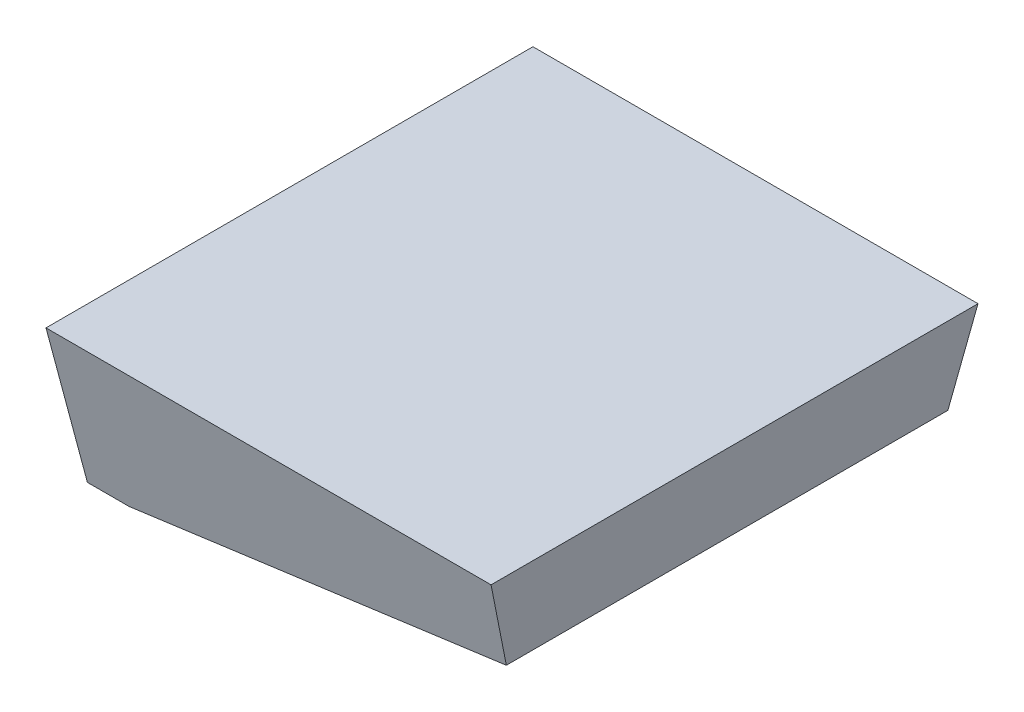
from build123d import *

# Parameters (mm, degrees)
TD_SKETCH_R                   = 1.586000003
TL_FEATURE_DEPTH              = 29.999999944
TDF_STD_SKETCH_W              = 3.191999966
TDF_STD_SKETCH_H              = 3.191999966
TDF_STD_FEATURE_DEPTH         = 31.083729633
ISA_20_STD_FEATURE_DEPTH      = 31.083729633
ISA_20_STD_FEATURE_DEPTH_BACK = 31.083729633
F_10BA_STD_FEATURE_DEPTH      = 31.083729633
F_10BA_STD_FEATURE_DEPTH_BACK = 31.083729633


with BuildPart() as part:
    # TD_sketch → TL_feature (new body)
    with BuildSketch(Plane(origin=(0, 0, 0), x_dir=(1, 0, 0), z_dir=(0, 1, 0))):
        with Locations(Location((0, 0, 0), (0, 0, 270))):
            Circle(TD_SKETCH_R)
    extrude(amount=TL_FEATURE_DEPTH)

    # TDF_STD_sketch → TDF_STD_feature (cut, through all)
    with BuildSketch(Plane(origin=(0, 0, 0), x_dir=(1, 0, 0), z_dir=(0, 1, 0))):
        with Locations((-2.80399998, 0)):
            Rectangle(TDF_STD_SKETCH_W, TDF_STD_SKETCH_H)
    extrude(amount=TDF_STD_FEATURE_DEPTH, mode=Mode.SUBTRACT)

    # ISA_20_STD_sketch → ISA_20_STD_feature (cut, two sides: drawn at the far end of the back side and taken through both)
    with BuildSketch(Plane(origin=(0, 0, 0), x_dir=(0, 0, -1), z_dir=(1, 0, 0)).offset(-ISA_20_STD_FEATURE_DEPTH_BACK)):
        Polygon((-27.363170453, 100.745481569), (-8.406975783, 29.999999944), (-0.368500025, 0), (0.368500025, 0), (8.406975783, 29.999999944), (27.363170453, 100.745481569), (27.363170453, -45.736742427), (-27.363170453, -45.736742427), align=None)
    extrude(amount=ISA_20_STD_FEATURE_DEPTH + ISA_20_STD_FEATURE_DEPTH_BACK, mode=Mode.SUBTRACT)

    # 10BA_STD_sketch → 10BA_STD_feature (cut, two sides: drawn at the far end of the back side and taken through both)
    with BuildSketch(Plane.XY.offset(-F_10BA_STD_FEATURE_DEPTH_BACK)):
        Polygon((-71.594734288, 0), (-1.207999997, 0), (-1.131799997, 0), (-0.409863005, 0.12729697), (2.203659854, 29.999999944), (8.338267961, 100.118891461), (118.350717996, 12.287061845), (38.417715748, -87.831829616), align=None)
    extrude(amount=F_10BA_STD_FEATURE_DEPTH + F_10BA_STD_FEATURE_DEPTH_BACK, mode=Mode.SUBTRACT)

    # cut_feature
    split(bisect_by=Plane(origin=(0, 0.281844732, 0), x_dir=(1, 0, 0), z_dir=(0, 1, 0)), keep=Keep.BOTTOM)


solid = part.part
